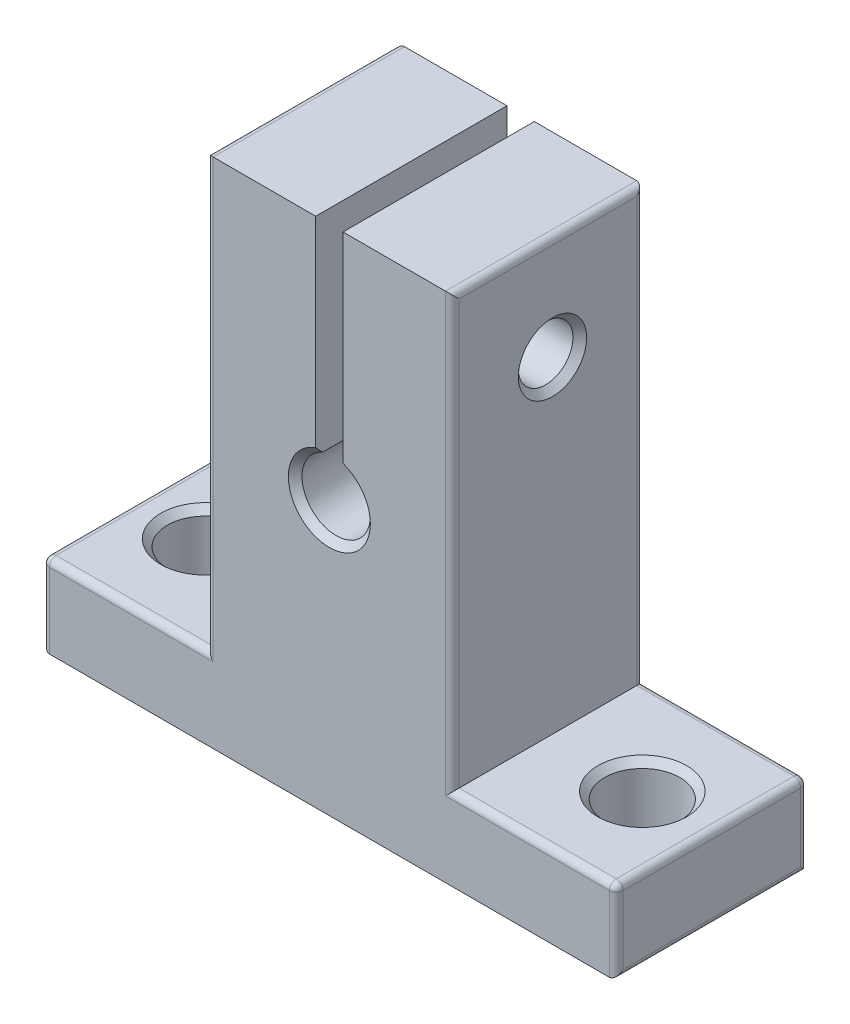
from build123d import *

# Parameters (mm, degrees)
BOSS_EXTRUDE1_DEPTH     = 7
SKETCH2_R               = 2.75
CUT_EXTRUDE1_DEPTH      = 39.5
CUT_EXTRUDE2_DEPTH      = 42.512046444
CUT_EXTRUDE2_DEPTH_BACK = 42.512046444
SKETCH5_R               = 2
CHAMFER2_SIZE           = 0.5
FILLET2_R               = 0.5


with BuildPart() as part:
    # Sketch1 → Boss-Extrude1 (new, symmetric)
    with BuildSketch(Plane.XY):
        with BuildLine():
            Line((-21, -3), (-21, 3))
            Line((-21, 3), (-9, 3))
            Line((-9, 3), (-9, 34.5))
            Line((-9, 34.5), (-1, 34.5))
            Line((-1, 34.5), (-1, 19.291287847))
            ThreePointArc((-1, 19.291287847), (0, 14.5), (1, 19.291287847))
            Line((1, 19.291287847), (1, 34.5))
            Line((1, 34.5), (9, 34.5))
            Line((9, 34.5), (9, 3))
            Line((9, 3), (21, 3))
            Line((21, 3), (21, -3))
            Line((21, -3), (-21, -3))
        make_face()
    extrude(amount=BOSS_EXTRUDE1_DEPTH, both=True)

    # Sketch2 → Cut-Extrude1 (cut, through all)
    with BuildSketch(Plane(origin=(0, 3, 0), x_dir=(1, 0, 0), z_dir=(0, 1, 0))):
        with Locations(Location((15.904501915, 0, 0), (0, 0, 180))):
            Circle(SKETCH2_R)
        with Locations((-16.095498085, 0)):
            Circle(SKETCH2_R)
    extrude(amount=-CUT_EXTRUDE1_DEPTH, mode=Mode.SUBTRACT)

    # Sketch5 → Cut-Extrude2 (cut, two sides: drawn at the far end of the back side and taken through both)
    with BuildSketch(Plane(origin=(-1, 0, 0), x_dir=(0, 0, -1), z_dir=(1, 0, 0)).offset(-CUT_EXTRUDE2_DEPTH_BACK)):
        with Locations((0.330734984, 26.895643924)):
            Circle(SKETCH5_R)
    extrude(amount=CUT_EXTRUDE2_DEPTH + CUT_EXTRUDE2_DEPTH_BACK, mode=Mode.SUBTRACT)

    # Chamfer2
    chamfer2_edges = [part.edges().sort_by_distance(p)[0] for p in [
        (0, 14.5, -7),
        (0, 14.5, 7),
        (18.654501915, 3, 0),
        (-18.845498085, 3, 0),
        (-9, 26.895643924, 1.669265016),
        (9, 26.895643924, 1.669265016),
    ]]
    chamfer(chamfer2_edges, length=CHAMFER2_SIZE)

    # Fillet2
    fillet2_edges = [part.edges().sort_by_distance(p)[0] for p in [
        (-15, 3, 7),
        (9, 18.75, -7),
        (15, 3, -7),
        (-21, 0, 7),
        (21, 0, -7),
        (-21, 0, -7),
        (-15, 3, -7),
        (-9, 18.75, -7),
        (21, 0, 7),
        (9, 34.5, 0),
        (21, 3, 0),
        (21, -3, 0),
        (-21, -3, 0),
        (-21, 3, 0),
        (-9, 34.5, 0),
        (15, 3, 7),
        (9, 18.75, 7),
        (-9, 18.75, 7),
    ]]
    fillet(fillet2_edges, radius=FILLET2_R)


solid = part.part
